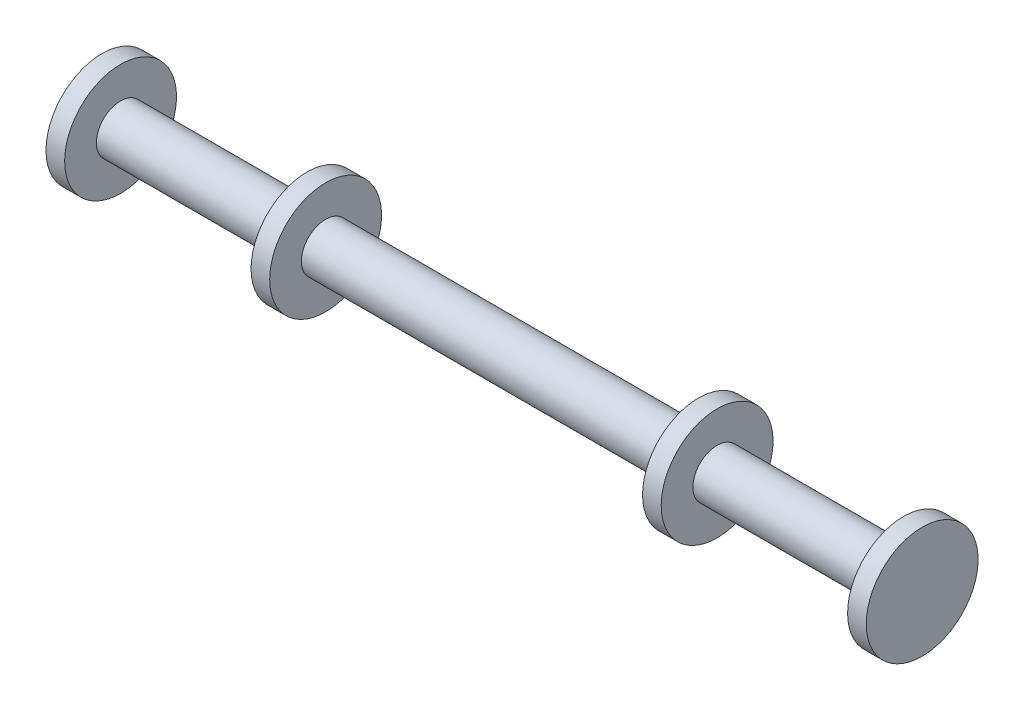
from build123d import *

# Parameters (mm, degrees)
SKETCH1_W = 111.76
SKETCH1_H = 3.302
SKETCH6_W = 2.54
SKETCH6_H = 4.318


with BuildPart() as part:
    # Sketch1 → Revolve1 (revolve)
    with BuildSketch(Plane.XY, mode=Mode.PRIVATE) as revolve1_sk:
        with Locations((0, 1.651)):
            Rectangle(SKETCH1_W, SKETCH1_H)
    revolve(revolve1_sk.sketch.rotate(Axis((-55.88, 0, 0), (1, 0, 0)), 90), axis=Axis((-55.88, 0, 0), (1, 0, 0)))

    # Sketch6 → Revolve2 (revolve)
    with BuildSketch(Plane.XY, mode=Mode.PRIVATE) as revolve2_sk:
        with Locations((-26.67, 5.461)):
            Rectangle(SKETCH6_W, SKETCH6_H)
        with Locations((26.67, 5.461)):
            Rectangle(SKETCH6_W, SKETCH6_H)
        with Locations((-54.61, 5.461)):
            Rectangle(SKETCH6_W, SKETCH6_H)
        with Locations((54.61, 5.461)):
            Rectangle(SKETCH6_W, SKETCH6_H)
    revolve(revolve2_sk.sketch.rotate(Axis((-31.878421892, 0, 0), (1, 0, 0)), 90), axis=Axis((-31.878421892, 0, 0), (1, 0, 0)))


solid = part.part
